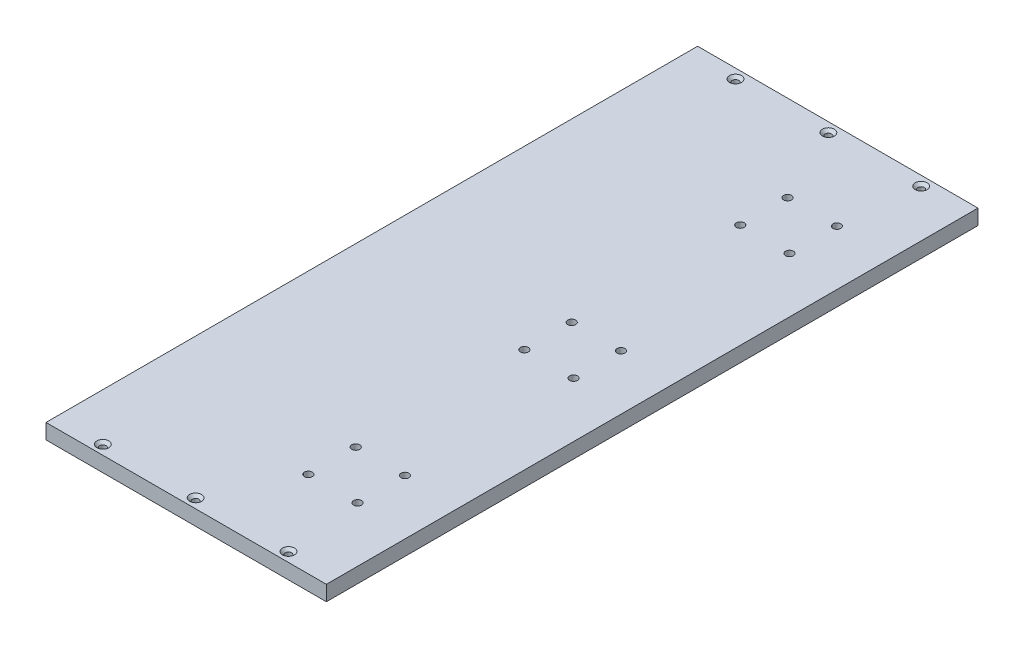
from build123d import *

# Parameters (mm, degrees)
SKETCH1_W                                    = 148
SKETCH1_H                                    = 344
BOSS_EXTRUDE1_DEPTH                          = 8
CSK_FOR_M3_COUNTERSUNK_FLAT_HEAD1_AT_2_COUNT = 2
CSK_FOR_M3_COUNTERSUNK_FLAT_HEAD1_AT_2_PITCH = 49
CSK_FOR_M3_COUNTERSUNK_FLAT_HEAD1_AT_3_COUNT = 2
CSK_FOR_M3_COUNTERSUNK_FLAT_HEAD1_AT_3_PITCH = 98
M5X0_8_TAPPED_HOLE1_D                        = 4.2
LPATTERN1_COUNT                              = 2
LPATTERN1_PITCH                              = 114
LPATTERN1_COL_COUNT                          = 2
LPATTERN1_COL_PITCH                          = 114


with BuildPart() as part:
    # Sketch1 → Boss-Extrude1 (new body)
    with BuildSketch(Plane(origin=(0, 0, 0), x_dir=(1, 0, 0), z_dir=(0, 1, 0))):
        Rectangle(SKETCH1_W, SKETCH1_H)
    extrude(amount=BOSS_EXTRUDE1_DEPTH)

    # Sketch3 → CSK for M3 Countersunk Flat Head1 (revolve, cut)
    with BuildSketch(Plane(origin=(-49, 8, 167), x_dir=(0, 0, 1), z_dir=(1, 0, 0))):
        Polygon((0, 0), (0, 16.021463052), (1.7, 15), (1.7, 1.45), (3.15, 0), align=None)
    csk_for_m3_countersunk_flat_head1 = revolve(axis=Axis((-49, 14.35, 167), (0, -1, 0)), mode=Mode.SUBTRACT)

    # CSK for M3 Countersunk Flat Head1 at 2: CSK for M3 Countersunk Flat Head1 ×2
    with Locations(*[(i * CSK_FOR_M3_COUNTERSUNK_FLAT_HEAD1_AT_2_PITCH, 0, 0) for i in range(1, CSK_FOR_M3_COUNTERSUNK_FLAT_HEAD1_AT_2_COUNT)]):
        add(csk_for_m3_countersunk_flat_head1, mode=Mode.SUBTRACT)

    # CSK for M3 Countersunk Flat Head1 at 3: CSK for M3 Countersunk Flat Head1 ×2
    with Locations(*[(i * CSK_FOR_M3_COUNTERSUNK_FLAT_HEAD1_AT_3_PITCH, 0, 0) for i in range(1, CSK_FOR_M3_COUNTERSUNK_FLAT_HEAD1_AT_3_COUNT)]):
        add(csk_for_m3_countersunk_flat_head1, mode=Mode.SUBTRACT)

    # Mirror1: CSK for M3 Countersunk Flat Head1 across plane
    add(csk_for_m3_countersunk_flat_head1.mirror(Plane.XY), mode=Mode.SUBTRACT)

    # Mirror1 copy 1 sketch → Mirror1 copy 1 (revolve, cut)
    with BuildSketch(Plane(origin=(0, 8, -167), x_dir=(0, 0, -1), z_dir=(1, 0, 0))):
        Polygon((0, 0), (0, -16.021463052), (1.7, -15), (1.7, -1.45), (3.15, 0), align=None)
    revolve(axis=Axis((0, 14.35, -167), (0, 1, 0)), mode=Mode.SUBTRACT)

    # Mirror1 copy 2 sketch → Mirror1 copy 2 (revolve, cut)
    with BuildSketch(Plane(origin=(49, 8, -167), x_dir=(0, 0, -1), z_dir=(1, 0, 0))):
        Polygon((0, 0), (0, -16.021463052), (1.7, -15), (1.7, -1.45), (3.15, 0), align=None)
    revolve(axis=Axis((49, 14.35, -167), (0, 1, 0)), mode=Mode.SUBTRACT)

    # M5x0.8 Tapped Hole1 (through all)
    with Locations(Plane(origin=(45, 8, -12.5), x_dir=(0, 0, 1), z_dir=(0, 1, 0))):
        with Locations((0, 0), (0, -26), (25, -26), (25, 0)):
            m5x0_8_tapped_hole1 = Hole(M5X0_8_TAPPED_HOLE1_D / 2)

    # LPattern1: M5x0.8 Tapped Hole1 ×2
    with Locations(*[(0, 0, i * LPATTERN1_PITCH) for i in range(1, LPATTERN1_COUNT)]):
        add(m5x0_8_tapped_hole1, mode=Mode.SUBTRACT)

    # LPattern1 col: M5x0.8 Tapped Hole1 ×2
    with Locations(*[(0, 0, -i * LPATTERN1_COL_PITCH) for i in range(1, LPATTERN1_COL_COUNT)]):
        add(m5x0_8_tapped_hole1, mode=Mode.SUBTRACT)


solid = part.part
